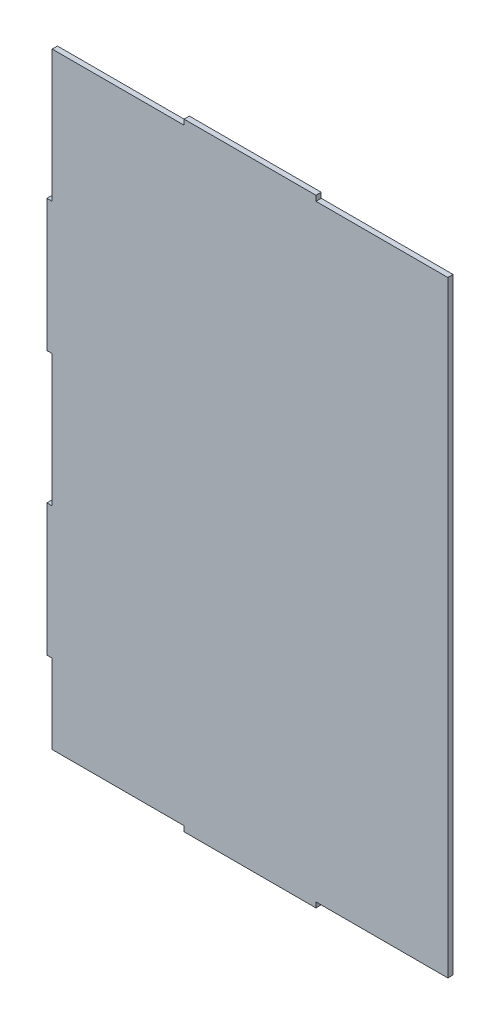
from build123d import *

# Parameters (mm, degrees)
EXTRUDE_1_DEPTH = 4


with BuildPart() as part:
    # 草图1 → 凸台-拉伸1 (new body)
    with BuildSketch(Plane.XY):
        Polygon((323.463115997, 208.167929075), (327.463115997, 208.167929075), (327.463115997, 148.167929075), (427.463115997, 148.167929075), (427.463115997, 144.167929075), (527.463115997, 144.167929075), (527.463115997, 148.167929075), (627.463115997, 148.167929075), (627.463115997, 208.167929075), (627.463115997, 508.167929075), (627.463115997, 608.167929075), (527.463115997, 608.167929075), (527.463115997, 612.167929075), (427.463115997, 612.167929075), (427.463115997, 608.167929075), (327.463115997, 608.167929075), (327.463115997, 508.167929075), (323.463115997, 508.167929075), (323.463115997, 408.167929075), (327.463115997, 408.167929075), (327.463115997, 308.167929075), (323.463115997, 308.167929075), align=None)
    extrude(amount=EXTRUDE_1_DEPTH)


solid = part.part
